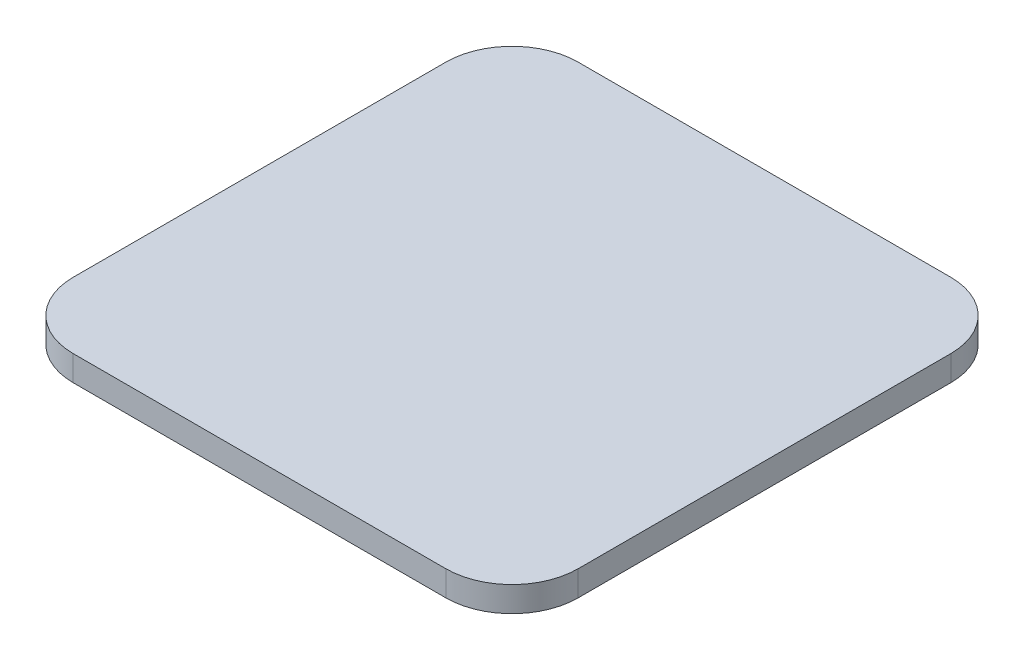
from build123d import *

# Parameters (mm, degrees)
BOSS_EXTRUDE1_DEPTH = 5.08
SKETCH2_R           = 38.1
BOSS_EXTRUDE2_DEPTH = 10.16
SKETCH3_R           = 2.54
SKETCH5_R           = 7.62
BOSS_EXTRUDE3_DEPTH = 27.94
CHAMFER4_SIZE       = 0.9906


with BuildPart() as part:
    # Sketch1 → Boss-Extrude1 (new body)
    with BuildSketch(Plane(origin=(0, 0, 0), x_dir=(1, 0, 0), z_dir=(0, 1, 0))):
        with BuildLine():
            Line((-37.495119859, 50.8), (37.495119859, 50.8))
            ThreePointArc((37.495119859, 50.8), (46.90309083, 46.90309083), (50.8, 37.495119859))
            Line((50.8, 37.495119859), (50.8, -37.495119859))
            ThreePointArc((50.8, -37.495119859), (46.90309083, -46.90309083), (37.495119859, -50.8))
            Line((37.495119859, -50.8), (-37.495119859, -50.8))
            ThreePointArc((-37.495119859, -50.8), (-46.90309083, -46.90309083), (-50.8, -37.495119859))
            Line((-50.8, -37.495119859), (-50.8, 37.495119859))
            ThreePointArc((-50.8, 37.495119859), (-46.90309083, 46.90309083), (-37.495119859, 50.8))
        make_face()
    extrude(amount=BOSS_EXTRUDE1_DEPTH)

    # Sketch2 → Boss-Extrude2 (add)
    with BuildSketch(Plane.XZ):
        with Locations(Location((0, 0, 0), (0, 0, 270))):
            Circle(SKETCH2_R)
    extrude(amount=BOSS_EXTRUDE2_DEPTH)

    # Sketch3 → Revolve1 (revolve)
    with BuildSketch(Plane(origin=(0, 0, 0), x_dir=(0, 0, -1), z_dir=(1, 0, 0)), mode=Mode.PRIVATE) as revolve1_sk:
        with Locations((-38.1, -7.62)):
            Circle(SKETCH3_R)
    revolve(revolve1_sk.sketch.rotate(Axis((0, 0, 0), (0, -1, 0)), 180), axis=Axis((0, 0, 0), (0, -1, 0)))

    # Sketch5 → Boss-Extrude3 (add)
    with BuildSketch(Plane.XZ.offset(10.16)):
        with Locations(Location((0, 0, 0), (0, 0, 270))):
            Circle(SKETCH5_R)
    extrude(amount=BOSS_EXTRUDE3_DEPTH)

    # Chamfer4
    chamfer4_edges = [part.edges().sort_by_distance(p)[0] for p in [
        (0, -38.1, 7.62),
    ]]
    chamfer(chamfer4_edges, length=CHAMFER4_SIZE)


solid = part.part
